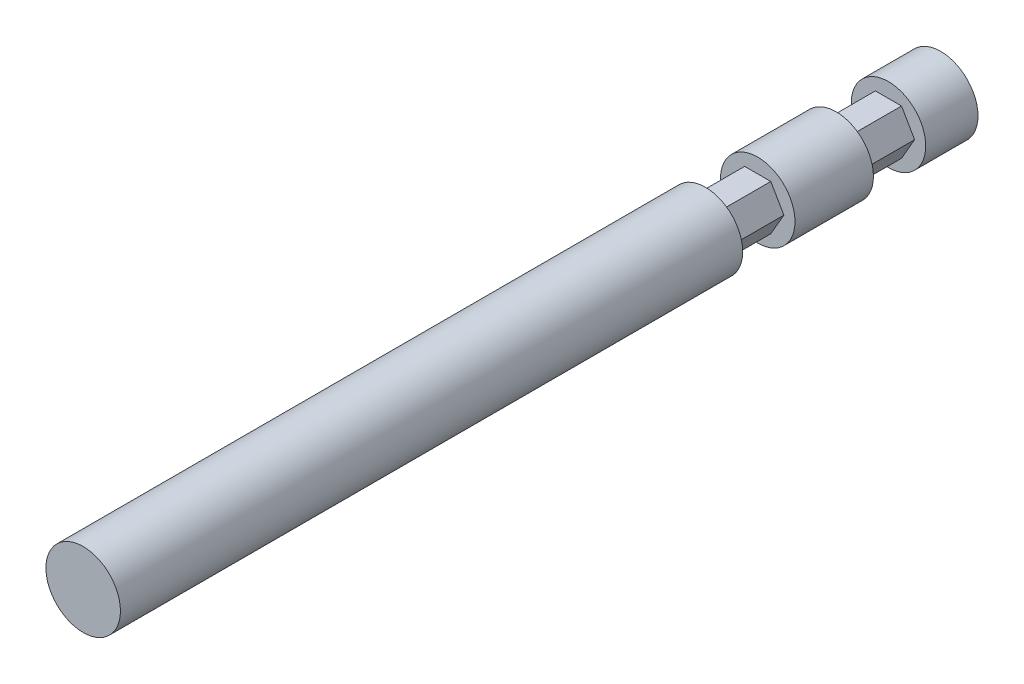
from build123d import *

# Parameters (mm, degrees)
SKETCH_1_R      = 2.85
EXTRUDE_1_DEPTH = 4
EXTRUDE_2_DEPTH = 4
SKETCH_3_R      = 2.85
EXTRUDE_3_DEPTH = 6
EXTRUDE_4_DEPTH = 4
SKETCH_5_R      = 2.85
EXTRUDE_5_DEPTH = 47.6


with BuildPart() as part:
    # 草图1 → 凸台-拉伸1 (new body)
    with BuildSketch(Plane.XY):
        Circle(SKETCH_1_R)
    extrude(amount=EXTRUDE_1_DEPTH)

    # 草图2 → 凸台-拉伸2 (add)
    with BuildSketch(Plane.XY.offset(4)):
        Polygon((2, 0), (1, 1.732050808), (-1, 1.732050808), (-2, 0), (-1, -1.732050808), (1, -1.732050808), align=None)
    extrude(amount=EXTRUDE_2_DEPTH)

    # 草图3 → 凸台-拉伸3 (add)
    with BuildSketch(Plane.XY.offset(8)):
        Circle(SKETCH_3_R)
    extrude(amount=EXTRUDE_3_DEPTH)

    # 草图4 → 凸台-拉伸4 (add)
    with BuildSketch(Plane.XY.offset(14)):
        Polygon((2, 0), (1, 1.732050808), (-1, 1.732050808), (-2, 0), (-1, -1.732050808), (1, -1.732050808), align=None)
    extrude(amount=EXTRUDE_4_DEPTH)

    # 草图5 → 凸台-拉伸5 (add)
    with BuildSketch(Plane.XY.offset(18)):
        Circle(SKETCH_5_R)
    extrude(amount=EXTRUDE_5_DEPTH)


solid = part.part
